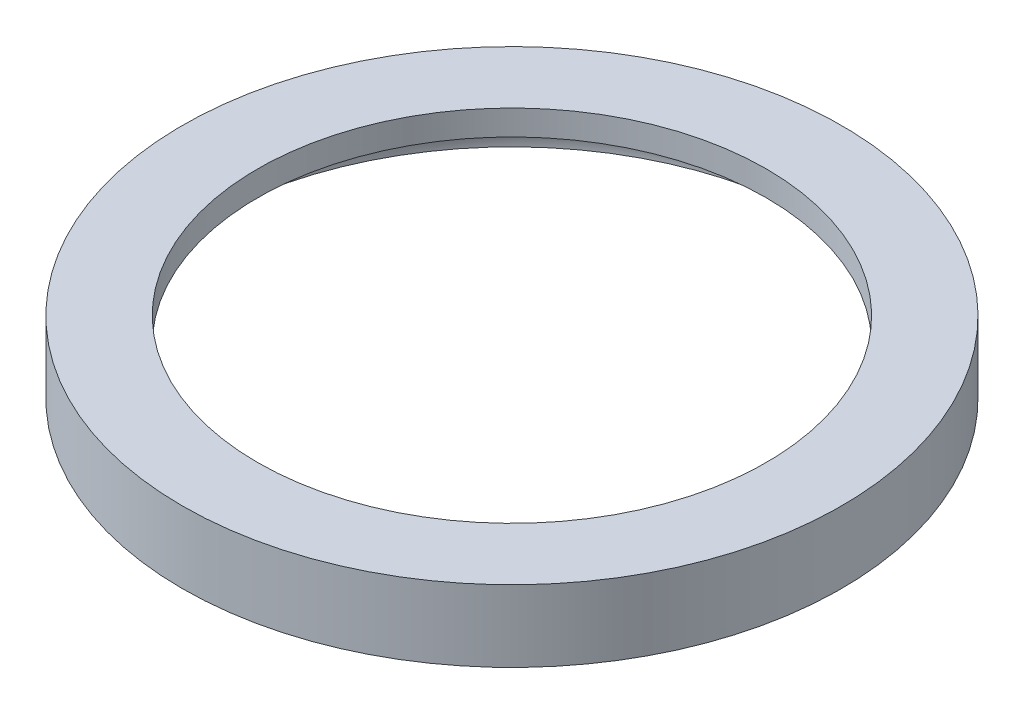
from build123d import *


with BuildPart() as part:
    # Sketch1 → Revolve1 (revolve)
    with BuildSketch(Plane(origin=(0, 0, 0), x_dir=(0, 0, -1), z_dir=(1, 0, 0))):
        with BuildLine():
            Line((-35.5, 4.506666604), (-46, 4.506666604))
            Line((-46, 4.506666604), (-46, -5.493333396))
            Line((-46, -5.493333396), (-43, -5.493333396))
            ThreePointArc((-43, -5.493333396), (-41.096194078, -0.897139319), (-36.5, 1.006666604))
            Line((-36.5, 1.006666604), (-35.5, 1.006666604))
            Line((-35.5, 1.006666604), (-35.5, 4.506666604))
        make_face()
    revolve(axis=Axis((0, 9.32617969, 0), (0, -1, 0)))


solid = part.part
